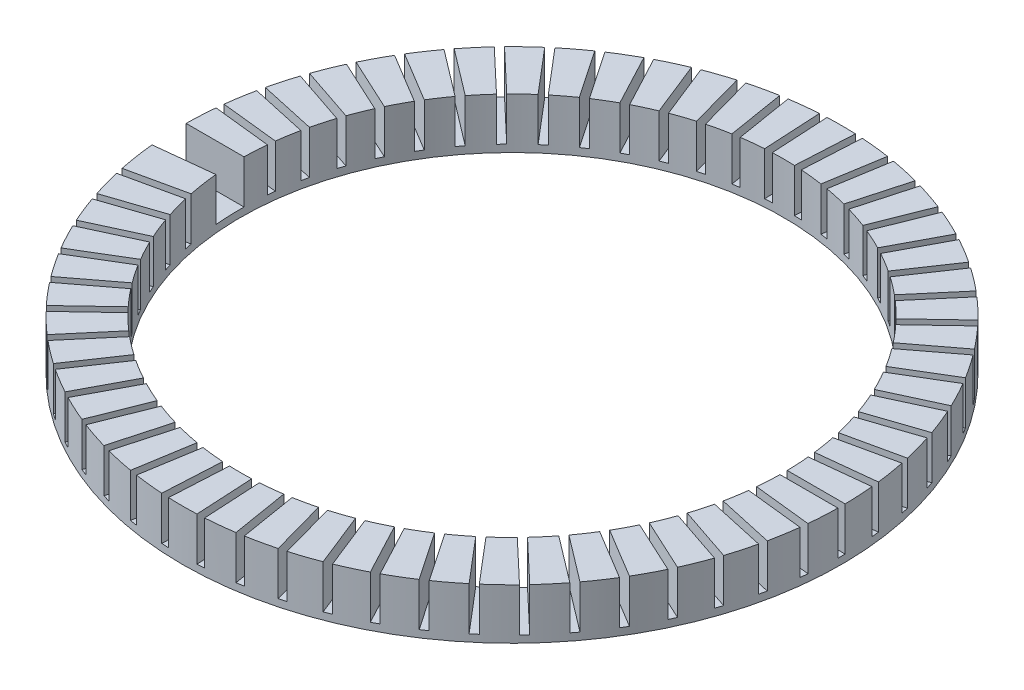
from build123d import *
from build123d.topology import SkipClean

# Parameters (mm, degrees)
SKETCH1_R           = 227.5
SKETCH1_R_2         = 187.5
BOSS_EXTRUDE1_DEPTH = 2.5
BOSS_EXTRUDE2_DEPTH = 30


with BuildPart() as part:
    # Sketch1 → Boss-Extrude1 (new, symmetric)
    with BuildSketch(Plane(origin=(0, 0, 0), x_dir=(1, 0, 0), z_dir=(0, 1, 0))):
        with Locations(Location((0, 0, 0), (0, 0, 270))):
            Circle(SKETCH1_R)
        with Locations(Location((0, 0, 0), (0, 0, 270))):
            Circle(SKETCH1_R_2, mode=Mode.SUBTRACT)
    extrude(amount=BOSS_EXTRUDE1_DEPTH, both=True)

    # Sketch2 → Boss-Extrude2 (add)
    with SkipClean():  # the faces are left unmerged after this step: merging them gives an invalid solid
        with BuildSketch(Plane(origin=(0, 2.5, 0), x_dir=(1, 0, 0), z_dir=(0, 1, 0))):
            with BuildLine():
                ThreePointArc((-226.423026645, 22.110246602), (-227.166351651, 12.316601703), (-227.486263322, 2.499999999))
                Line((-227.486263322, 2.499999999), (-187.483332593, 2.499999999))
                ThreePointArc((-187.483332593, 2.499999999), (-187.225015097, 10.151045359), (-186.65459481, 17.785168997))
                Line((-186.65459481, 17.785168997), (-226.423026645, 22.110246602))
            make_face()
            with BuildLine():
                ThreePointArc((-222.705187002, 46.461270778), (-224.503033878, 36.805404215), (-225.882431553, 27.080936388))
                Line((-225.882431553, 27.080936388), (-186.113999718, 22.755858783))
                ThreePointArc((-186.113999718, 22.755858783), (-185.029972977, 30.334124353), (-183.637502564, 37.86182315))
                Line((-183.637502564, 37.86182315), (-222.705187002, 46.461270778))
            make_face()
            with BuildLine():
                ThreePointArc((147.741245475, -115.450311327), (142.905385337, -121.384928396), (137.83130292, -127.117197638))
                Line((137.83130292, -127.117197638), (166.873250293, -154.627191453))
                ThreePointArc((166.873250293, -154.627191453), (173.391867542, -147.280379787), (179.587301236, -139.659053537))
                Line((179.587301236, -139.659053537), (147.741245475, -115.450311327))
            make_face()
            with BuildLine():
                Line((163.434752999, -158.257168912), (134.392805626, -130.747175097))
                ThreePointArc((134.392805626, -130.747175097), (128.943648535, -136.124154735), (123.279543284, -141.274216359))
                Line((123.279543284, -141.274216359), (149.176891989, -171.762932254))
                ThreePointArc((149.176891989, -171.762932254), (156.45162689, -165.163974412), (163.434752999, -158.257168912))
            make_face()
            with BuildLine():
                Line((145.366081713, -174.999863678), (119.468733008, -144.511147782))
                ThreePointArc((119.468733008, -144.511147782), (113.470165349, -149.267449819), (107.282443718, -153.774924061))
                Line((107.282443718, -153.774924061), (129.73157102, -186.884909719))
                ThreePointArc((129.73157102, -186.884909719), (137.677133957, -181.111172448), (145.366081713, -174.999863678))
            make_face()
            with BuildLine():
                Line((125.593126029, -189.690845046), (103.143998727, -156.580859388))
                ThreePointArc((103.143998727, -156.580859388), (96.666348221, -160.660720531), (90.027555589, -164.472761376))
                Line((90.027555589, -164.472761376), (108.765265995, -199.815832489))
                ThreePointArc((108.765265995, -199.815832489), (117.288502508, -194.935007578), (125.593126029, -189.690845046))
            make_face()
            with BuildLine():
                Line((104.347705772, -202.157874692), (85.609995366, -166.81480358))
                ThreePointArc((85.609995366, -166.81480358), (78.729206543, -170.170391188), (71.717176683, -173.242305944))
                Line((71.717176683, -173.242305944), (86.523787671, -210.404097315))
                ThreePointArc((86.523787671, -210.404097315), (95.524770606, -206.473407975), (104.347705772, -202.157874692))
            make_face()
            with BuildLine():
                Line((81.878904072, -212.254788092), (67.072293084, -175.09299672))
                ThreePointArc((67.072293084, -175.09299672), (59.869036901, -177.684969597), (52.565979452, -179.980742871))
                Line((52.565979452, -179.980742871), (63.267897047, -218.525566475))
                ThreePointArc((63.267897047, -218.525566475), (72.641098107, -215.591096444), (81.878904072, -212.254788092))
            make_face()
            with BuildLine():
                Line((58.450147084, -219.863208168), (47.74822949, -181.318384563))
                ThreePointArc((47.74822949, -181.318384563), (40.30695754, -183.116354196), (32.798494174, -184.609070145))
                Line((32.798494174, -184.609070145), (39.270248175, -224.085023168))
                ThreePointArc((39.270248175, -224.085023168), (48.905775149, -222.181176424), (58.450147084, -219.863208168))
            make_face()
            with BuildLine():
                Line((34.336115563, -224.893933151), (27.864361561, -185.417980128))
                ThreePointArc((27.864361561, -185.417980128), (20.272315955, -186.400866966), (12.64647654, -187.073024862))
                Line((12.64647654, -187.073024862), (14.81219155, -227.017287847))
                ThreePointArc((14.81219155, -227.017287847), (24.597076692, -226.166385253), (34.336115563, -224.893933151))
            make_face()
            with BuildLine():
                Line((9.81952448, -227.28798239), (7.65380947, -187.343719405))
                ThreePointArc((7.65380947, -187.343719405), (1e-09, -187.5), (-7.653809469, -187.343719405))
                Line((-7.653809469, -187.343719405), (-9.819524479, -227.28798239))
                ThreePointArc((-9.819524479, -227.28798239), (1e-09, -227.5), (9.81952448, -227.28798239))
            make_face()
            with BuildLine():
                Line((-14.812191548, -227.017287847), (-12.646476539, -187.073024862))
                ThreePointArc((-12.646476539, -187.073024862), (-20.272315954, -186.400866967), (-27.86436156, -185.417980128))
                Line((-27.86436156, -185.417980128), (-34.336115562, -224.893933151))
                ThreePointArc((-34.336115562, -224.893933151), (-24.597076691, -226.166385253), (-14.812191548, -227.017287847))
            make_face()
            with BuildLine():
                Line((-39.270248174, -224.085023168), (-32.798494173, -184.609070146))
                ThreePointArc((-32.798494173, -184.609070146), (-40.306957539, -183.116354196), (-47.748229489, -181.318384563))
                Line((-47.748229489, -181.318384563), (-58.450147083, -219.863208168))
                ThreePointArc((-58.450147083, -219.863208168), (-48.905775147, -222.181176424), (-39.270248174, -224.085023168))
            make_face()
            with BuildLine():
                Line((-63.267897045, -218.525566476), (-52.565979451, -179.980742871))
                ThreePointArc((-52.565979451, -179.980742871), (-59.8690369, -177.684969597), (-67.072293083, -175.092996721))
                Line((-67.072293083, -175.092996721), (-81.878904071, -212.254788092))
                ThreePointArc((-81.878904071, -212.254788092), (-72.641098105, -215.591096444), (-63.267897045, -218.525566476))
            make_face()
            with BuildLine():
                Line((-86.52378767, -210.404097316), (-71.717176682, -173.242305944))
                ThreePointArc((-71.717176682, -173.242305944), (-78.729206542, -170.170391189), (-85.609995365, -166.81480358))
                Line((-85.609995365, -166.81480358), (-104.347705771, -202.157874693))
                ThreePointArc((-104.347705771, -202.157874693), (-95.524770604, -206.473407975), (-86.52378767, -210.404097316))
            make_face()
            with BuildLine():
                Line((-108.765265994, -199.815832489), (-90.027555587, -164.472761377))
                ThreePointArc((-90.027555587, -164.472761377), (-96.66634822, -160.660720532), (-103.143998726, -156.580859388))
                Line((-103.143998726, -156.580859388), (-125.593126028, -189.690845047))
                ThreePointArc((-125.593126028, -189.690845047), (-117.288502507, -194.935007578), (-108.765265994, -199.815832489))
            make_face()
            with BuildLine():
                Line((-129.731571019, -186.88490972), (-107.282443717, -153.774924062))
                ThreePointArc((-107.282443717, -153.774924062), (-113.470165348, -149.26744982), (-119.468733007, -144.511147783))
                Line((-119.468733007, -144.511147783), (-145.366081712, -174.999863679))
                ThreePointArc((-145.366081712, -174.999863679), (-137.677133956, -181.111172448), (-129.731571019, -186.88490972))
            make_face()
            with BuildLine():
                Line((-149.176891988, -171.762932255), (-123.279543283, -141.274216359))
                ThreePointArc((-123.279543283, -141.274216359), (-128.943648535, -136.124154736), (-134.392805625, -130.747175098))
                Line((-134.392805625, -130.747175098), (-163.434752998, -158.257168913))
                ThreePointArc((-163.434752998, -158.257168913), (-156.451626889, -165.163974413), (-149.176891988, -171.762932255))
            make_face()
            with BuildLine():
                Line((-166.873250293, -154.627191453), (-137.83130292, -127.117197639))
                ThreePointArc((-137.83130292, -127.117197639), (-142.905385336, -121.384928397), (-147.741245474, -115.450311328))
                Line((-147.741245474, -115.450311328), (-179.587301235, -139.659053538))
                ThreePointArc((-179.587301235, -139.659053538), (-173.391867541, -147.280379788), (-166.873250293, -154.627191453))
            make_face()
            with BuildLine():
                Line((-182.613172311, -135.678588209), (-150.76711655, -111.469846))
                ThreePointArc((-150.76711655, -111.469846), (-155.191687154, -105.222574756), (-159.3575543, -98.799898215))
                Line((-159.3575543, -98.799898215), (-193.634352563, -119.423563451))
                ThreePointArc((-193.634352563, -119.423563451), (-188.29924708, -127.67005737), (-182.613172311, -135.678588209))
            make_face()
            with BuildLine():
                Line((-196.212121849, -115.13927757), (-161.935323586, -94.515612335))
                ThreePointArc((-161.935323586, -94.515612335), (-165.658508333, -87.826582632), (-169.105541505, -80.99114663))
                Line((-169.105541505, -80.99114663), (-205.411218149, -97.787941273))
                ThreePointArc((-205.411218149, -97.787941273), (-200.998990111, -106.56292026), (-196.212121849, -115.13927757))
            make_face()
            with BuildLine():
                Line((-207.510663657, -93.250064175), (-171.204987013, -76.453269531))
                ThreePointArc((-171.204987013, -76.453269531), (-174.183134965, -69.400904127), (-176.87092085, -62.2328479))
                Line((-176.87092085, -62.2328479), (-214.779825012, -75.005844892))
                ThreePointArc((-214.779825012, -75.005844892), (-211.342203758, -84.20643034), (-207.510663657, -93.250064175))
            make_face()
            with BuildLine():
                Line((-216.376332662, -70.267579036), (-178.4674285, -57.494582044))
                ThreePointArc((-178.4674285, -57.494582044), (-180.665623597, -50.161563475), (-182.562650362, -42.74492593))
                Line((-182.562650362, -42.74492593), (-221.630334801, -51.344373558))
                ThreePointArc((-221.630334801, -51.344373558), (-219.207623298, -60.862697016), (-216.376332662, -70.267579036))
            make_face()
            with BuildLine():
                Line((-222.705187002, -46.46127078), (-183.637502563, -37.861823151))
                ThreePointArc((-183.637502563, -37.861823151), (-185.417980128, -27.864361561), (-186.65459481, -17.785168998))
                Line((-186.65459481, -17.785168998), (-226.423026645, -22.110246603))
                ThreePointArc((-226.423026645, -22.110246603), (-224.893933151, -34.336115563), (-222.705187002, -46.46127078))
            make_face()
            with BuildLine():
                ThreePointArc((-216.376332663, 70.267579035), (-219.207623298, 60.862697015), (-221.630334801, 51.344373557))
                Line((-221.630334801, 51.344373557), (-182.562650363, 42.744925928))
                ThreePointArc((-182.562650363, 42.744925928), (-180.665623598, 50.161563474), (-178.467428501, 57.494582043))
                Line((-178.467428501, 57.494582043), (-216.376332663, 70.267579035))
            make_face()
            with BuildLine():
                ThreePointArc((-207.510663658, 93.250064174), (-211.342203759, 84.206430339), (-214.779825012, 75.005844891))
                Line((-214.779825012, 75.005844891), (-176.87092085, 62.232847899))
                ThreePointArc((-176.87092085, 62.232847899), (-174.183134966, 69.400904126), (-171.204987013, 76.45326953))
                Line((-171.204987013, 76.45326953), (-207.510663658, 93.250064174))
            make_face()
            with BuildLine():
                ThreePointArc((-196.21212185, 115.139277569), (-200.998990112, 106.562920259), (-205.41121815, 97.787941272))
                Line((-205.41121815, 97.787941272), (-169.105541505, 80.991146628))
                ThreePointArc((-169.105541505, 80.991146628), (-165.658508334, 87.826582631), (-161.935323587, 94.515612334))
                Line((-161.935323587, 94.515612334), (-196.21212185, 115.139277569))
            make_face()
            with BuildLine():
                ThreePointArc((-182.613172312, 135.678588208), (-188.299247081, 127.670057369), (-193.634352564, 119.42356345))
                Line((-193.634352564, 119.42356345), (-159.357554301, 98.799898214))
                ThreePointArc((-159.357554301, 98.799898214), (-155.191687155, 105.222574755), (-150.767116551, 111.469845999))
                Line((-150.767116551, 111.469845999), (-182.613172312, 135.678588208))
            make_face()
            with BuildLine():
                ThreePointArc((-166.873250293, 154.627191453), (-173.391867542, 147.280379787), (-179.587301236, 139.659053537))
                Line((-179.587301236, 139.659053537), (-147.741245475, 115.450311327))
                ThreePointArc((-147.741245475, 115.450311327), (-142.905385337, 121.384928396), (-137.83130292, 127.117197638))
                Line((-137.83130292, 127.117197638), (-166.873250293, 154.627191453))
            make_face()
            with BuildLine():
                ThreePointArc((-149.176891989, 171.762932254), (-156.45162689, 165.163974412), (-163.434752999, 158.257168912))
                Line((-163.434752999, 158.257168912), (-134.392805626, 130.747175097))
                ThreePointArc((-134.392805626, 130.747175097), (-128.943648535, 136.124154735), (-123.279543284, 141.274216359))
                Line((-123.279543284, 141.274216359), (-149.176891989, 171.762932254))
            make_face()
            with BuildLine():
                ThreePointArc((-129.73157102, 186.884909719), (-137.677133957, 181.111172448), (-145.366081713, 174.999863678))
                Line((-145.366081713, 174.999863678), (-119.468733008, 144.511147782))
                ThreePointArc((-119.468733008, 144.511147782), (-113.470165349, 149.267449819), (-107.282443718, 153.774924061))
                Line((-107.282443718, 153.774924061), (-129.73157102, 186.884909719))
            make_face()
            with BuildLine():
                ThreePointArc((-108.765265995, 199.815832489), (-117.288502508, 194.935007578), (-125.593126029, 189.690845046))
                Line((-125.593126029, 189.690845046), (-103.143998727, 156.580859388))
                ThreePointArc((-103.143998727, 156.580859388), (-96.666348221, 160.660720531), (-90.027555589, 164.472761376))
                Line((-90.027555589, 164.472761376), (-108.765265995, 199.815832489))
            make_face()
            with BuildLine():
                ThreePointArc((-86.523787671, 210.404097315), (-95.524770606, 206.473407975), (-104.347705772, 202.157874692))
                Line((-104.347705772, 202.157874692), (-85.609995366, 166.81480358))
                ThreePointArc((-85.609995366, 166.81480358), (-78.729206543, 170.170391188), (-71.717176683, 173.242305944))
                Line((-71.717176683, 173.242305944), (-86.523787671, 210.404097315))
            make_face()
            with BuildLine():
                ThreePointArc((-63.267897047, 218.525566475), (-72.641098107, 215.591096444), (-81.878904072, 212.254788092))
                Line((-81.878904072, 212.254788092), (-67.072293084, 175.09299672))
                ThreePointArc((-67.072293084, 175.09299672), (-59.869036901, 177.684969597), (-52.565979452, 179.980742871))
                Line((-52.565979452, 179.980742871), (-63.267897047, 218.525566475))
            make_face()
            with BuildLine():
                ThreePointArc((-39.270248175, 224.085023168), (-48.905775149, 222.181176424), (-58.450147084, 219.863208168))
                Line((-58.450147084, 219.863208168), (-47.74822949, 181.318384563))
                ThreePointArc((-47.74822949, 181.318384563), (-40.30695754, 183.116354196), (-32.798494174, 184.609070145))
                Line((-32.798494174, 184.609070145), (-39.270248175, 224.085023168))
            make_face()
            with BuildLine():
                ThreePointArc((-14.81219155, 227.017287847), (-24.597076692, 226.166385253), (-34.336115563, 224.893933151))
                Line((-34.336115563, 224.893933151), (-27.864361561, 185.417980128))
                ThreePointArc((-27.864361561, 185.417980128), (-20.272315955, 186.400866966), (-12.64647654, 187.073024862))
                Line((-12.64647654, 187.073024862), (-14.81219155, 227.017287847))
            make_face()
            with BuildLine():
                ThreePointArc((9.819524479, 227.28798239), (-1e-09, 227.5), (-9.81952448, 227.28798239))
                Line((-9.81952448, 227.28798239), (-7.65380947, 187.343719405))
                ThreePointArc((-7.65380947, 187.343719405), (-1e-09, 187.5), (7.653809469, 187.343719405))
                Line((7.653809469, 187.343719405), (9.819524479, 227.28798239))
            make_face()
            with BuildLine():
                ThreePointArc((34.336115562, 224.893933151), (24.597076691, 226.166385253), (14.812191548, 227.017287847))
                Line((14.812191548, 227.017287847), (12.646476539, 187.073024862))
                ThreePointArc((12.646476539, 187.073024862), (20.272315954, 186.400866967), (27.86436156, 185.417980128))
                Line((27.86436156, 185.417980128), (34.336115562, 224.893933151))
            make_face()
            with BuildLine():
                ThreePointArc((58.450147083, 219.863208168), (48.905775147, 222.181176424), (39.270248174, 224.085023168))
                Line((39.270248174, 224.085023168), (32.798494173, 184.609070146))
                ThreePointArc((32.798494173, 184.609070146), (40.306957539, 183.116354196), (47.748229489, 181.318384563))
                Line((47.748229489, 181.318384563), (58.450147083, 219.863208168))
            make_face()
            with BuildLine():
                ThreePointArc((81.878904071, 212.254788092), (72.641098105, 215.591096444), (63.267897045, 218.525566476))
                Line((63.267897045, 218.525566476), (52.565979451, 179.980742871))
                ThreePointArc((52.565979451, 179.980742871), (59.8690369, 177.684969597), (67.072293083, 175.092996721))
                Line((67.072293083, 175.092996721), (81.878904071, 212.254788092))
            make_face()
            with BuildLine():
                ThreePointArc((104.347705771, 202.157874693), (95.524770604, 206.473407975), (86.52378767, 210.404097316))
                Line((86.52378767, 210.404097316), (71.717176682, 173.242305944))
                ThreePointArc((71.717176682, 173.242305944), (78.729206542, 170.170391189), (85.609995365, 166.81480358))
                Line((85.609995365, 166.81480358), (104.347705771, 202.157874693))
            make_face()
            with BuildLine():
                ThreePointArc((125.593126028, 189.690845047), (117.288502507, 194.935007578), (108.765265994, 199.815832489))
                Line((108.765265994, 199.815832489), (90.027555587, 164.472761377))
                ThreePointArc((90.027555587, 164.472761377), (96.66634822, 160.660720532), (103.143998726, 156.580859388))
                Line((103.143998726, 156.580859388), (125.593126028, 189.690845047))
            make_face()
            with BuildLine():
                ThreePointArc((145.366081712, 174.999863679), (137.677133956, 181.111172448), (129.731571019, 186.88490972))
                Line((129.731571019, 186.88490972), (107.282443717, 153.774924062))
                ThreePointArc((107.282443717, 153.774924062), (113.470165348, 149.26744982), (119.468733007, 144.511147783))
                Line((119.468733007, 144.511147783), (145.366081712, 174.999863679))
            make_face()
            with BuildLine():
                ThreePointArc((163.434752998, 158.257168913), (156.451626889, 165.163974413), (149.176891988, 171.762932255))
                Line((149.176891988, 171.762932255), (123.279543283, 141.274216359))
                ThreePointArc((123.279543283, 141.274216359), (128.943648535, 136.124154736), (134.392805625, 130.747175098))
                Line((134.392805625, 130.747175098), (163.434752998, 158.257168913))
            make_face()
            with BuildLine():
                ThreePointArc((179.587301235, 139.659053538), (173.391867541, 147.280379788), (166.873250293, 154.627191453))
                Line((166.873250293, 154.627191453), (137.83130292, 127.117197639))
                ThreePointArc((137.83130292, 127.117197639), (142.905385336, 121.384928397), (147.741245474, 115.450311328))
                Line((147.741245474, 115.450311328), (179.587301235, 139.659053538))
            make_face()
            with BuildLine():
                ThreePointArc((193.634352563, 119.423563451), (188.29924708, 127.67005737), (182.613172311, 135.678588209))
                Line((182.613172311, 135.678588209), (150.76711655, 111.469846))
                ThreePointArc((150.76711655, 111.469846), (155.191687154, 105.222574756), (159.3575543, 98.799898215))
                Line((159.3575543, 98.799898215), (193.634352563, 119.423563451))
            make_face()
            with BuildLine():
                ThreePointArc((205.411218149, 97.787941273), (200.998990111, 106.56292026), (196.212121849, 115.13927757))
                Line((196.212121849, 115.13927757), (161.935323586, 94.515612335))
                ThreePointArc((161.935323586, 94.515612335), (165.658508333, 87.826582632), (169.105541505, 80.99114663))
                Line((169.105541505, 80.99114663), (205.411218149, 97.787941273))
            make_face()
            with BuildLine():
                ThreePointArc((214.779825012, 75.005844892), (211.342203758, 84.20643034), (207.510663657, 93.250064175))
                Line((207.510663657, 93.250064175), (171.204987013, 76.453269531))
                ThreePointArc((171.204987013, 76.453269531), (174.183134965, 69.400904127), (176.87092085, 62.2328479))
                Line((176.87092085, 62.2328479), (214.779825012, 75.005844892))
            make_face()
            with BuildLine():
                ThreePointArc((221.630334801, 51.344373558), (219.207623298, 60.862697016), (216.376332662, 70.267579036))
                Line((216.376332662, 70.267579036), (178.4674285, 57.494582044))
                ThreePointArc((178.4674285, 57.494582044), (180.665623597, 50.161563475), (182.562650362, 42.74492593))
                Line((182.562650362, 42.74492593), (221.630334801, 51.344373558))
            make_face()
            with BuildLine():
                ThreePointArc((225.882431553, 27.080936389), (224.503033878, 36.805404216), (222.705187002, 46.46127078))
                Line((222.705187002, 46.46127078), (183.637502563, 37.861823151))
                ThreePointArc((183.637502563, 37.861823151), (185.029972976, 30.334124354), (186.113999718, 22.755858784))
                Line((186.113999718, 22.755858784), (225.882431553, 27.080936389))
            make_face()
            with BuildLine():
                ThreePointArc((227.486263322, 2.500000001), (227.166351651, 12.316601704), (226.423026645, 22.110246603))
                Line((226.423026645, 22.110246603), (186.65459481, 17.785168998))
                ThreePointArc((186.65459481, 17.785168998), (187.225015097, 10.15104536), (187.483332593, 2.500000001))
                Line((187.483332593, 2.500000001), (227.486263322, 2.500000001))
            make_face()
            with BuildLine():
                ThreePointArc((226.423026645, -22.110246602), (227.166351651, -12.316601703), (227.486263322, -2.499999999))
                Line((227.486263322, -2.499999999), (187.483332593, -2.499999999))
                ThreePointArc((187.483332593, -2.499999999), (187.225015097, -10.151045359), (186.65459481, -17.785168997))
                Line((186.65459481, -17.785168997), (226.423026645, -22.110246602))
            make_face()
            with BuildLine():
                ThreePointArc((222.705187002, -46.461270778), (224.503033878, -36.805404215), (225.882431553, -27.080936388))
                Line((225.882431553, -27.080936388), (186.113999718, -22.755858783))
                ThreePointArc((186.113999718, -22.755858783), (185.029972977, -30.334124353), (183.637502564, -37.86182315))
                Line((183.637502564, -37.86182315), (222.705187002, -46.461270778))
            make_face()
            with BuildLine():
                ThreePointArc((216.376332663, -70.267579035), (219.207623298, -60.862697015), (221.630334801, -51.344373557))
                Line((221.630334801, -51.344373557), (182.562650363, -42.744925928))
                ThreePointArc((182.562650363, -42.744925928), (180.665623598, -50.161563474), (178.467428501, -57.494582043))
                Line((178.467428501, -57.494582043), (216.376332663, -70.267579035))
            make_face()
            with BuildLine():
                ThreePointArc((207.510663658, -93.250064174), (211.342203759, -84.206430339), (214.779825012, -75.005844891))
                Line((214.779825012, -75.005844891), (176.87092085, -62.232847899))
                ThreePointArc((176.87092085, -62.232847899), (174.183134966, -69.400904126), (171.204987013, -76.45326953))
                Line((171.204987013, -76.45326953), (207.510663658, -93.250064174))
            make_face()
            with BuildLine():
                ThreePointArc((196.21212185, -115.139277569), (200.998990112, -106.562920259), (205.41121815, -97.787941272))
                Line((205.41121815, -97.787941272), (169.105541505, -80.991146628))
                ThreePointArc((169.105541505, -80.991146628), (165.658508334, -87.826582631), (161.935323587, -94.515612334))
                Line((161.935323587, -94.515612334), (196.21212185, -115.139277569))
            make_face()
            with BuildLine():
                ThreePointArc((182.613172312, -135.678588208), (188.299247081, -127.670057369), (193.634352564, -119.42356345))
                Line((193.634352564, -119.42356345), (159.357554301, -98.799898214))
                ThreePointArc((159.357554301, -98.799898214), (155.191687155, -105.222574755), (150.767116551, -111.469845999))
                Line((150.767116551, -111.469845999), (182.613172312, -135.678588208))
            make_face()
        extrude(amount=BOSS_EXTRUDE2_DEPTH)


solid = part.part
